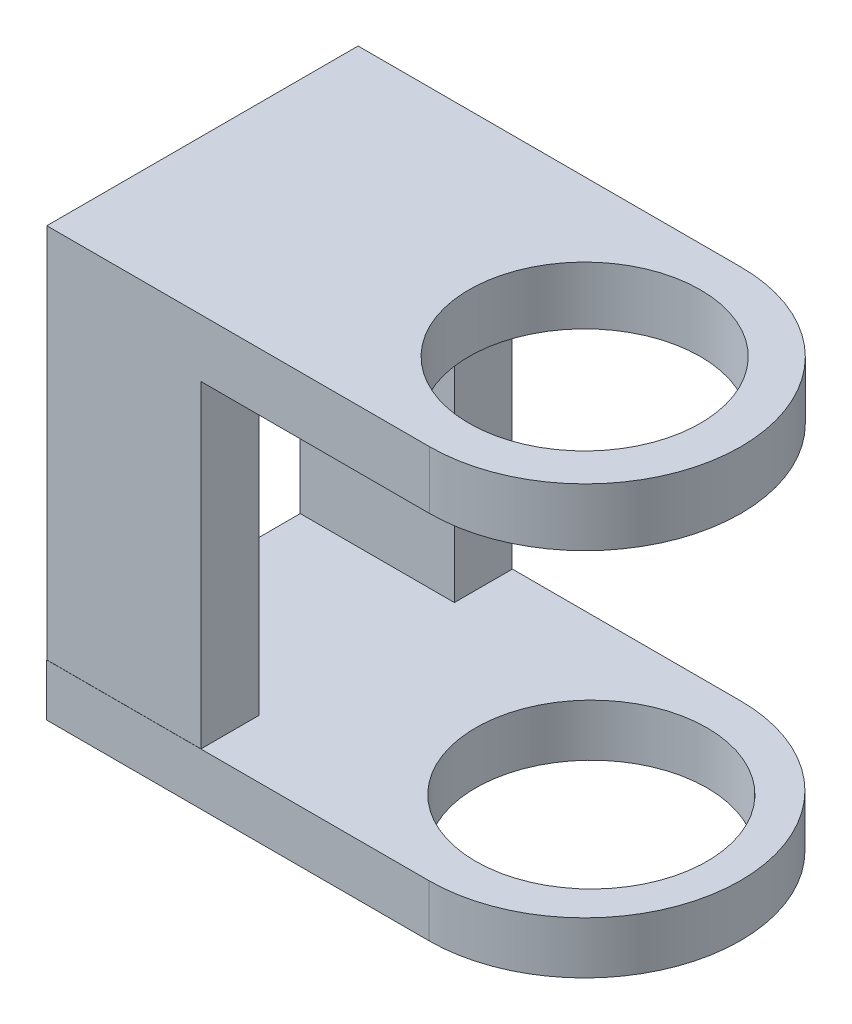
from build123d import *

# Parameters (mm, degrees)
SALIENTE_EXTRUIR1_DEPTH = 10
CROQUIS2_R              = 20
CORTAR_EXTRUIR1_DEPTH   = 10
CROQUIS3_R              = 20
CORTAR_EXTRUIR2_DEPTH   = 10
CROQUIS5_W              = 60
CROQUIS5_H              = 10
SALIENTE_EXTRUIR3_DEPTH = 55
SALIENTE_EXTRUIR4_DEPTH = 9
CROQUIS8_R              = 20
CORTAR_EXTRUIR3_DEPTH   = 9
CROQUIS9_R              = 20
CORTAR_EXTRUIR4_DEPTH   = 10
CROQUIS11_W             = 94.452906293
CROQUIS11_H             = 104.053500068
CORTAR_EXTRUIR6_DEPTH   = 54
CROQUIS15_W             = 76.60704733
CROQUIS15_H             = 9.910818825
CORTAR_EXTRUIR7_DEPTH   = 76


with BuildPart() as part:
    # Croquis1 → Saliente-Extruir1 (new body)
    with BuildSketch(Plane(origin=(0, 0, 0), x_dir=(1, 0, 0), z_dir=(0, 1, 0))):
        with BuildLine():
            Line((0, 26.904276051), (128.079511341, 26.904276051))
            ThreePointArc((128.079511341, 26.904276051), (154.983787391, 0), (128.079511341, -26.904276051))
            Line((128.079511341, -26.904276051), (0, -26.904276051))
            ThreePointArc((0, -26.904276051), (-26.904276051, 0), (0, 26.904276051))
        make_face()
    extrude(amount=SALIENTE_EXTRUIR1_DEPTH)

    # Croquis2 → Cortar-Extruir1 (cut)
    with BuildSketch(Plane.XZ):
        with Locations(Location((0, 0, 0), (0, 0, 270))):
            Circle(CROQUIS2_R)
    extrude(amount=-CORTAR_EXTRUIR1_DEPTH, mode=Mode.SUBTRACT)

    # Croquis3 → Cortar-Extruir2 (cut)
    with BuildSketch(Plane(origin=(0, 10, 0), x_dir=(1, 0, 0), z_dir=(0, 1, 0))):
        with Locations(Location((127.980340476, 0, 0), (0, 0, 270))):
            Circle(CROQUIS3_R)
    extrude(amount=-CORTAR_EXTRUIR2_DEPTH, mode=Mode.SUBTRACT)

    # Croquis5 → Saliente-Extruir3 (add)
    with BuildSketch(Plane(origin=(0, 0, 0), x_dir=(-1, 0, 0), z_dir=(0, -1, 0))):
        with Locations((-58.558456053, -21.904276051)):
            Rectangle(CROQUIS5_W, CROQUIS5_H)
        with Locations((-58.558456053, 21.904276051)):
            Rectangle(CROQUIS5_W, CROQUIS5_H)
    extrude(amount=SALIENTE_EXTRUIR3_DEPTH)

    # Croquis7 → Saliente-Extruir4 (add)
    with BuildSketch(Plane(origin=(0, -55, 0), x_dir=(-1, 0, 0), z_dir=(0, -1, 0))):
        with BuildLine():
            Line((0, -26.929773303), (-127.980340476, -26.929773303))
            ThreePointArc((-127.980340476, -26.929773303), (-154.910113778, 0), (-127.980340476, 26.929773303))
            Line((-127.980340476, 26.929773303), (0, 26.929773303))
            ThreePointArc((0, 26.929773303), (26.929773303, 0), (0, -26.929773303))
        make_face()
    extrude(amount=SALIENTE_EXTRUIR4_DEPTH)

    # Croquis8 → Cortar-Extruir3 (cut)
    with BuildSketch(Plane(origin=(0, -64, 0), x_dir=(-1, 0, 0), z_dir=(0, -1, 0))):
        with Locations(Location((-129.139989333, 0, 0), (0, 0, 90))):
            Circle(CROQUIS8_R)
    extrude(amount=-CORTAR_EXTRUIR3_DEPTH, mode=Mode.SUBTRACT)

    # Croquis9 → Cortar-Extruir4 (cut)
    with BuildSketch(Plane(origin=(0, -64, 0), x_dir=(-1, 0, 0), z_dir=(0, -1, 0))):
        with Locations(Location((0, 0, 0), (0, 0, 90))):
            Circle(CROQUIS9_R)
    extrude(amount=-CORTAR_EXTRUIR4_DEPTH, mode=Mode.SUBTRACT)

    # Croquis11 → Cortar-Extruir6 (cut)
    with BuildSketch(Plane.XY.offset(26.929773303)):
        with Locations((14.683121645, -22.540401026)):
            Rectangle(CROQUIS11_W, CROQUIS11_H)
    extrude(amount=-CORTAR_EXTRUIR6_DEPTH, mode=Mode.SUBTRACT)

    # Croquis15 → Cortar-Extruir7 (cut)
    with BuildSketch(Plane(origin=(61.909574791, 10, 26.705021593), x_dir=(1, 0, 0), z_dir=(0, 1, 0))):
        with Locations((-38.303523665, -4.955409412)):
            Rectangle(CROQUIS15_W, CROQUIS15_H)
    extrude(amount=-CORTAR_EXTRUIR7_DEPTH, mode=Mode.SUBTRACT)


solid = part.part
